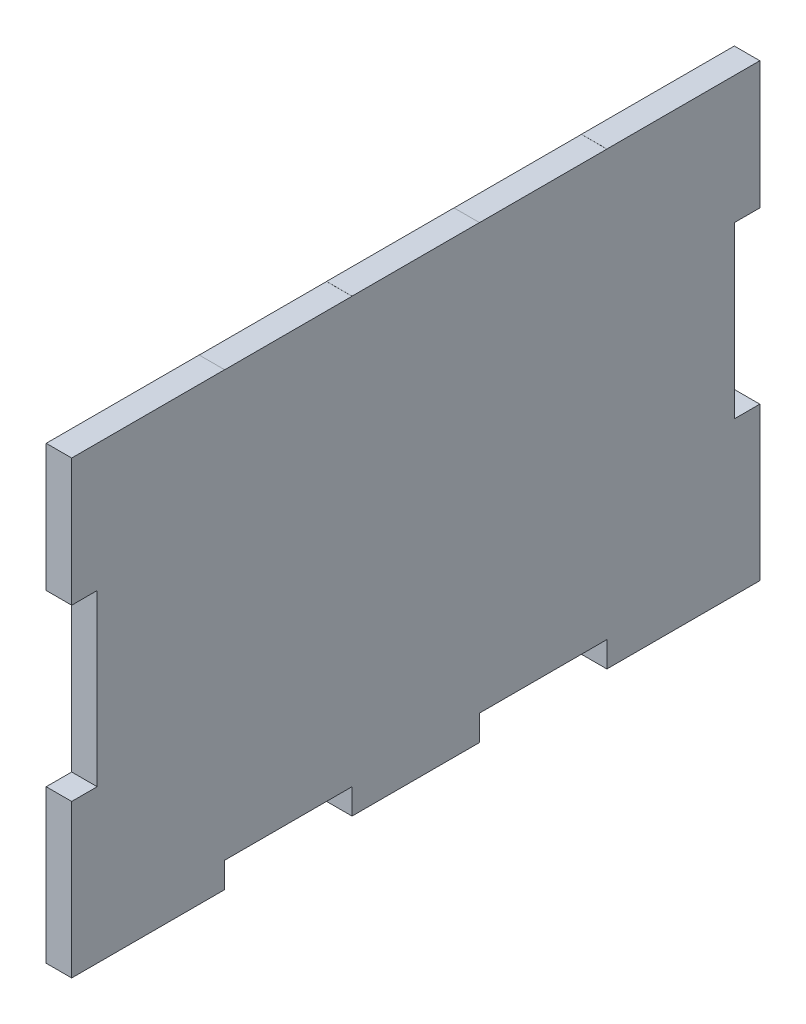
from build123d import *

# Parameters (mm, degrees)
ESBO_O1_W                = 150
ESBO_O1_H                = 100
RESSALTO_EXTRUS_O1_DEPTH = 6
ESBO_O3_W                = 6
ESBO_O3_H                = 30
RESSALTO_EXTRUS_O2_DEPTH = 6
ESBO_O4_W                = 6
ESBO_O4_H                = 30
RESSALTO_EXTRUS_O3_DEPTH = 6
ESBO_O6_W                = 6
ESBO_O6_H                = 36
RESSALTO_EXTRUS_O4_DEPTH = 6
ESBO_O7_W                = 6
ESBO_O7_H                = 36
RESSALTO_EXTRUS_O5_DEPTH = 6
ESBO_O8_W                = 162
ESBO_O8_H                = 5.982470976
CORTE_EXTRUS_O1_DEPTH    = 6


with BuildPart() as part:
    # Esboço1 → Ressalto-extrusão1 (new body)
    with BuildSketch(Plane(origin=(0, 0, 0), x_dir=(0, 0, -1), z_dir=(1, 0, 0))):
        Rectangle(ESBO_O1_W, ESBO_O1_H)
    extrude(amount=RESSALTO_EXTRUS_O1_DEPTH)

    # Esboço3 → Ressalto-extrusão2 (add)
    with BuildSketch(Plane(origin=(0, 50, 0), x_dir=(1, 0, 0), z_dir=(0, 1, 0))):
        with Locations((3, 60)):
            Rectangle(ESBO_O3_W, ESBO_O3_H)
        with Locations((3, 0)):
            Rectangle(ESBO_O3_W, ESBO_O3_H)
        with Locations((3, -60)):
            Rectangle(ESBO_O3_W, ESBO_O3_H)
    extrude(amount=RESSALTO_EXTRUS_O2_DEPTH)

    # Esboço4 → Ressalto-extrusão3 (add)
    with BuildSketch(Plane.XZ.offset(50)):
        with Locations((3, 60)):
            Rectangle(ESBO_O4_W, ESBO_O4_H)
        with Locations((3, 0)):
            Rectangle(ESBO_O4_W, ESBO_O4_H)
        with Locations((3, -60)):
            Rectangle(ESBO_O4_W, ESBO_O4_H)
    extrude(amount=RESSALTO_EXTRUS_O3_DEPTH)

    # Esboço6 → Ressalto-extrusão4 (add)
    with BuildSketch(Plane.XY.offset(75)):
        with Locations((3, 38)):
            Rectangle(ESBO_O6_W, ESBO_O6_H)
        with Locations((3, -38)):
            Rectangle(ESBO_O6_W, ESBO_O6_H)
    extrude(amount=RESSALTO_EXTRUS_O4_DEPTH)

    # Esboço7 → Ressalto-extrusão5 (add)
    with BuildSketch(Plane(origin=(0, 0, -75), x_dir=(-1, 0, 0), z_dir=(0, 0, -1))):
        with Locations((-3, -38)):
            Rectangle(ESBO_O7_W, ESBO_O7_H)
        with Locations((-3, 38)):
            Rectangle(ESBO_O7_W, ESBO_O7_H)
    extrude(amount=RESSALTO_EXTRUS_O5_DEPTH)

    # Esboço8 → Corte-extrusão1 (cut)
    with BuildSketch(Plane.ZY):
        with Locations((0, 53.008764512)):
            Rectangle(ESBO_O8_W, ESBO_O8_H)
    extrude(amount=-CORTE_EXTRUS_O1_DEPTH, mode=Mode.SUBTRACT)


solid = part.part
